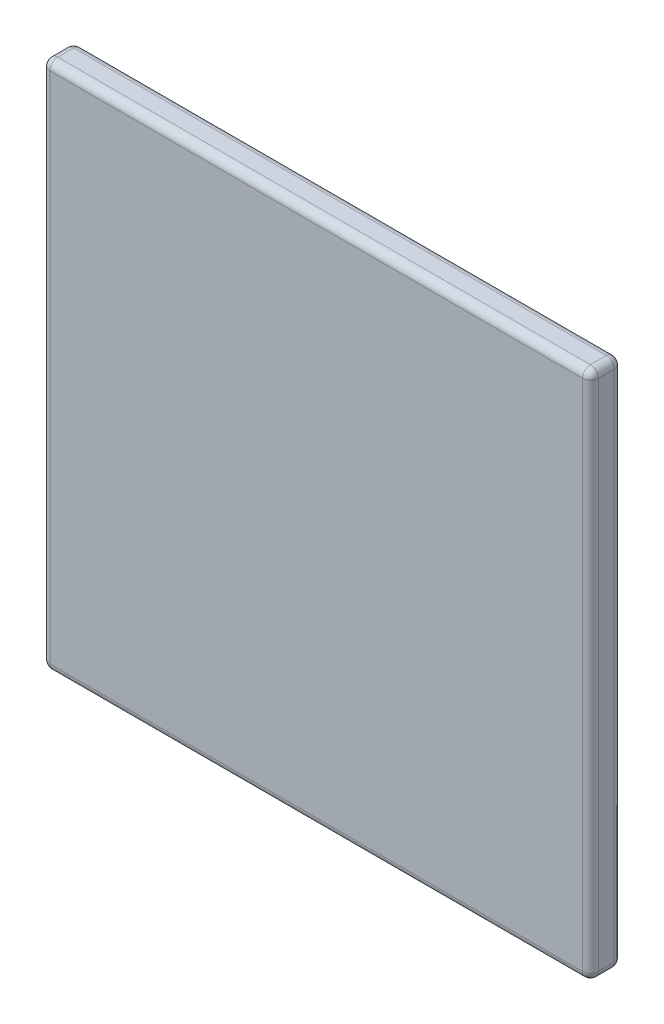
from build123d import *

# Parameters (mm, degrees)
SKETCH1_W           = 34.7
SKETCH1_H           = 33.5
BOSS_EXTRUDE1_DEPTH = 2
FILLET1_R           = 0.5


with BuildPart() as part:
    # Sketch1 → Boss-Extrude1 (new body)
    with BuildSketch(Plane.XY):
        Rectangle(SKETCH1_W, SKETCH1_H)
    extrude(amount=BOSS_EXTRUDE1_DEPTH)

    # Fillet1
    fillet1_edges = [part.edges().sort_by_distance(p)[0] for p in [
        (-17.35, 0, 2),
        (0, -16.75, 2),
        (17.35, 0, 2),
        (0, -16.75, 0),
        (-17.35, 0, 0),
        (0, 16.75, 0),
        (17.35, 0, 0),
        (17.35, -16.75, 1),
        (-17.35, -16.75, 1),
        (-17.35, 16.75, 1),
        (17.35, 16.75, 1),
        (0, 16.75, 2),
    ]]
    fillet(fillet1_edges, radius=FILLET1_R)


solid = part.part
